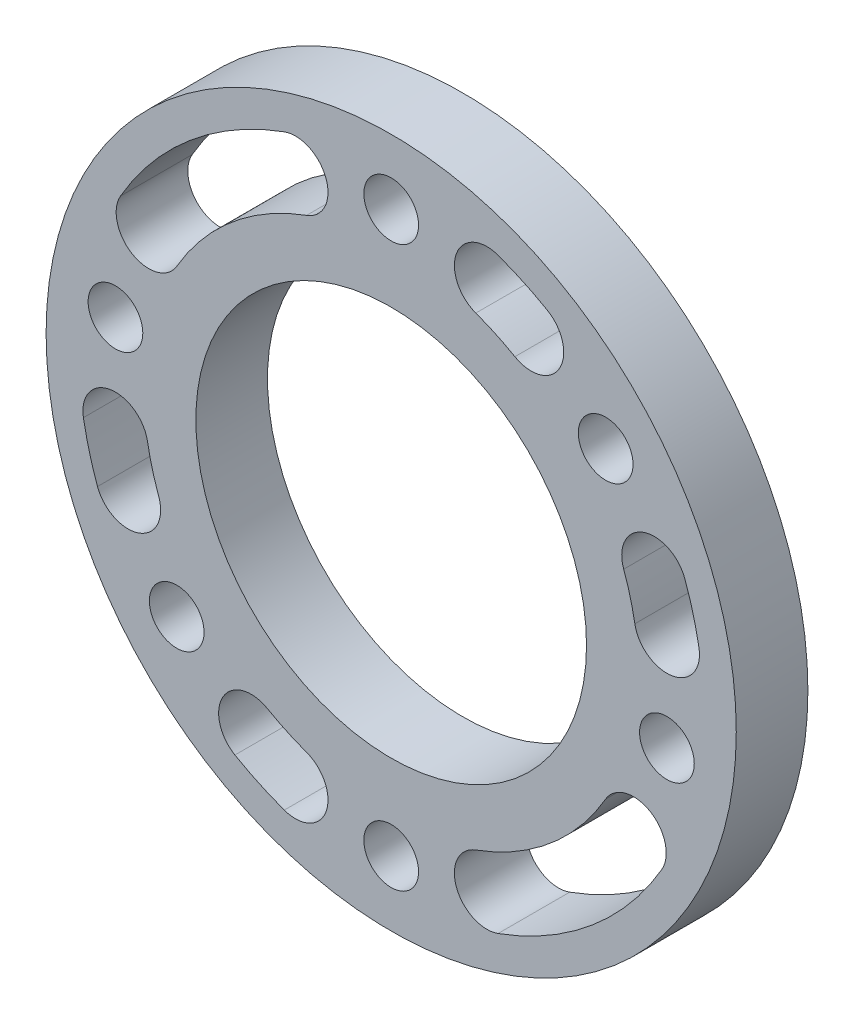
from build123d import *

# Parameters (mm, degrees)
SKETCH_1_R      = 26.5
SKETCH_1_R_2    = 15
SKETCH_1_R_3    = 2.1
EXTRUDE_1_DEPTH = 5.5


with BuildPart() as part:
    # 草图1 → 凸台-拉伸1 (new body)
    with BuildSketch(Plane.XY):
        Circle(SKETCH_1_R)
        Circle(SKETCH_1_R_2, mode=Mode.SUBTRACT)
        with Locations((0, 21.5)):
            Circle(SKETCH_1_R_3, mode=Mode.SUBTRACT)
        with Locations((16.469955527, 13.819933608)):
            Circle(SKETCH_1_R_3, mode=Mode.SUBTRACT)
        with Locations((21.17336669, -3.73343582)):
            Circle(SKETCH_1_R_3, mode=Mode.SUBTRACT)
        with Locations((0, -21.5)):
            Circle(SKETCH_1_R_3, mode=Mode.SUBTRACT)
        with Locations((-16.469955527, -13.819933608)):
            Circle(SKETCH_1_R_3, mode=Mode.SUBTRACT)
        with Locations((-21.17336669, 3.73343582)):
            Circle(SKETCH_1_R_3, mode=Mode.SUBTRACT)
        with BuildLine():
            ThreePointArc((-8.20848344, 22.552622899), (-15.426902632, 18.385066635), (-20.784609691, 12))
            ThreePointArc((-20.784609691, 12), (-19.869546181, 8.584936491), (-16.454482672, 9.5))
            ThreePointArc((-16.454482672, 9.5), (-12.212964584, 14.554844419), (-6.498382723, 17.854159795))
            ThreePointArc((-6.498382723, 17.854159795), (-5.00420153, 21.058441705), (-8.20848344, 22.552622899))
        make_face(mode=Mode.SUBTRACT)
        with BuildLine():
            ThreePointArc((12, 20.784609691), (10.142838282, 21.751386889), (8.20848344, 22.552622899))
            ThreePointArc((8.20848344, 22.552622899), (5.00420153, 21.058441705), (6.498382723, 17.854159795))
            ThreePointArc((6.498382723, 17.854159795), (8.029746973, 17.219847954), (9.5, 16.454482672))
            ThreePointArc((9.5, 16.454482672), (12.915063509, 17.369546181), (12, 20.784609691))
        make_face(mode=Mode.SUBTRACT)
        with BuildLine():
            ThreePointArc((18.711347307, 3.299315376), (18.352590699, 4.917561857), (17.854159795, 6.498382723))
            ThreePointArc((17.854159795, 6.498382723), (19.348340989, 9.702664633), (22.552622899, 8.20848344))
            ThreePointArc((22.552622899, 8.20848344), (23.182219831, 6.211657082), (23.635386072, 4.167556264))
            ThreePointArc((23.635386072, 4.167556264), (21.607487134, 1.271416437), (18.711347307, 3.299315376))
        make_face(mode=Mode.SUBTRACT)
        with BuildLine():
            ThreePointArc((6.498382723, -17.854159795), (12.212964584, -14.554844419), (16.454482672, -9.5))
            ThreePointArc((16.454482672, -9.5), (19.869546181, -8.584936491), (20.784609691, -12))
            ThreePointArc((20.784609691, -12), (15.426902632, -18.385066635), (8.20848344, -22.552622899))
            ThreePointArc((8.20848344, -22.552622899), (5.00420153, -21.058441705), (6.498382723, -17.854159795))
        make_face(mode=Mode.SUBTRACT)
        with BuildLine():
            ThreePointArc((-9.5, -16.454482672), (-8.029746973, -17.219847954), (-6.498382723, -17.854159795))
            ThreePointArc((-6.498382723, -17.854159795), (-5.00420153, -21.058441705), (-8.20848344, -22.552622899))
            ThreePointArc((-8.20848344, -22.552622899), (-10.142838282, -21.751386889), (-12, -20.784609691))
            ThreePointArc((-12, -20.784609691), (-12.915063509, -17.369546181), (-9.5, -16.454482672))
        make_face(mode=Mode.SUBTRACT)
        with BuildLine():
            ThreePointArc((-23.635386072, -4.167556264), (-23.182219831, -6.211657082), (-22.552622899, -8.20848344))
            ThreePointArc((-22.552622899, -8.20848344), (-19.348340989, -9.702664633), (-17.854159795, -6.498382723))
            ThreePointArc((-17.854159795, -6.498382723), (-18.352590699, -4.917561857), (-18.711347307, -3.299315376))
            ThreePointArc((-18.711347307, -3.299315376), (-21.607487134, -1.271416437), (-23.635386072, -4.167556264))
        make_face(mode=Mode.SUBTRACT)
    extrude(amount=EXTRUDE_1_DEPTH)


solid = part.part
